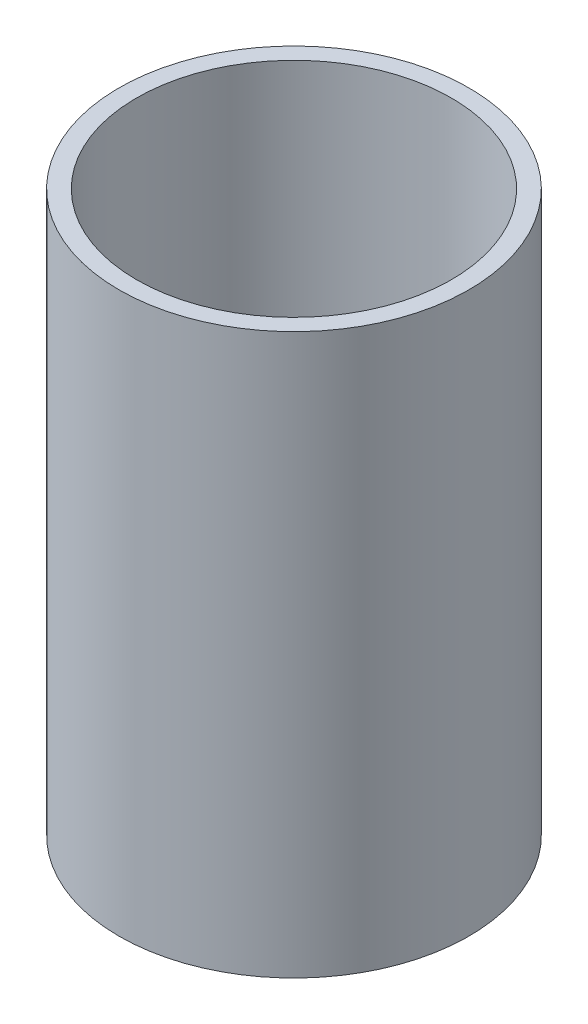
from build123d import *

# Parameters (mm, degrees)
SKETCH1_R           = 2.5
BOSS_EXTRUDE2_DEPTH = 8
SKETCH2_R           = 2.25
CUT_EXTRUDE1_DEPTH  = 7.2


with BuildPart() as part:
    # Sketch1 → Boss-Extrude2 (new body)
    with BuildSketch(Plane(origin=(0, 0, 0), x_dir=(1, 0, 0), z_dir=(0, 1, 0))):
        with Locations(Location((-3.487849653, 0.99262099, 0), (0, 0, 270))):
            Circle(SKETCH1_R)
    extrude(amount=BOSS_EXTRUDE2_DEPTH)

    # Sketch2 → Cut-Extrude1 (cut)
    with BuildSketch(Plane(origin=(0, 8, 0), x_dir=(1, 0, 0), z_dir=(0, 1, 0))):
        with Locations(Location((-3.487849653, 0.99262099, 0), (0, 0, 270))):
            Circle(SKETCH2_R)
    extrude(amount=-CUT_EXTRUDE1_DEPTH, mode=Mode.SUBTRACT)


solid = part.part
